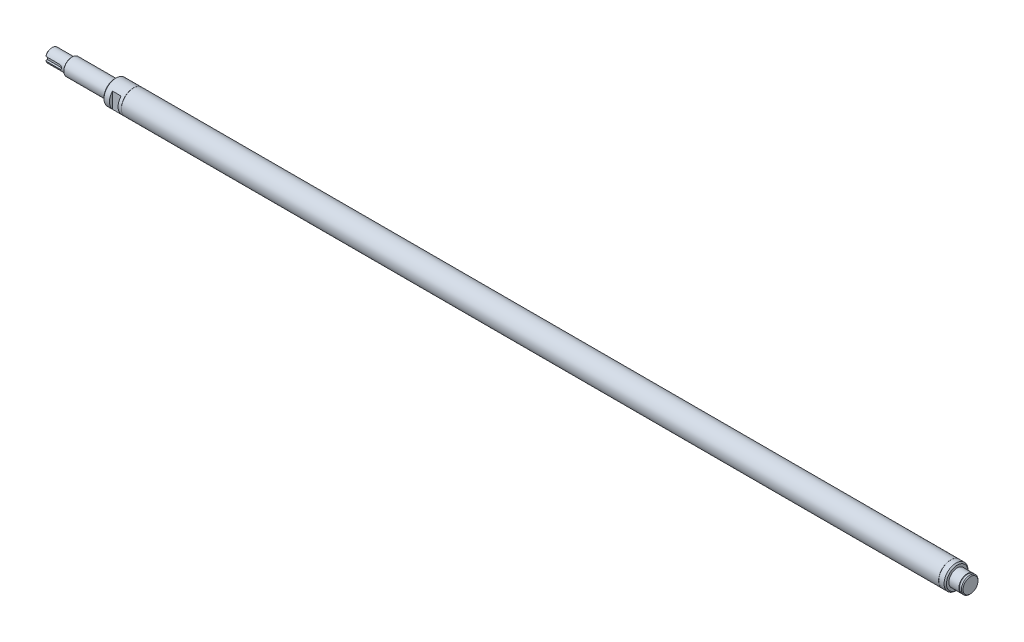
from build123d import *

# Parameters (mm, degrees)
SKETCH1_W          = 1229
SKETCH1_H          = 18
SKETCH3_W          = 13
SKETCH3_H          = 36
CUT_EXTRUDE1_DEPTH = 9
SKETCH4_W          = 13
SKETCH4_H          = 36
CUT_EXTRUDE2_DEPTH = 9
CUT_EXTRUDE3_DEPTH = 3.5


with BuildPart() as part:
    # Sketch1 → Revolve1 (revolve)
    with BuildSketch(Plane.XY, mode=Mode.PRIVATE) as revolve1_sk:
        with Locations((619.5, 9)):
            Rectangle(SKETCH1_W, SKETCH1_H)
    revolve(revolve1_sk.sketch.rotate(Axis((1234, 0, 0), (-1, 0, 0)), 180), axis=Axis((1234, 0, 0), (-1, 0, 0)))

    # Sketch2 → Revolve2 (revolve)
    with BuildSketch(Plane.XY, mode=Mode.PRIVATE) as revolve2_sk:
        Polygon((-118, 0), (-118, 8.888888889), (-116.888888889, 10), (-88, 10), (-88, 11.58), (-87.08, 12.5), (-23, 12.5), (-23, 16.2), (-21.2, 18), (4.8, 18), (4.8, 14.4), (5, 14.4), (5, 0), align=None)
    revolve(revolve2_sk.sketch.rotate(Axis((5, 0, 0), (-1, 0, 0)), 180), axis=Axis((5, 0, 0), (-1, 0, 0)))

    # Sketch3 → Cut-Extrude1 (cut)
    with BuildSketch(Plane.XY.offset(13.5)):
        with Locations((-6.5, 0)):
            Rectangle(SKETCH3_W, SKETCH3_H)
    extrude(amount=CUT_EXTRUDE1_DEPTH, mode=Mode.SUBTRACT)

    # Sketch4 → Cut-Extrude2 (cut)
    with BuildSketch(Plane.XY.offset(-13.5)):
        with Locations((-6.5, 0)):
            Rectangle(SKETCH4_W, SKETCH4_H)
    extrude(amount=-CUT_EXTRUDE2_DEPTH, mode=Mode.SUBTRACT)

    # Sketch5 → Cut-Extrude3 (cut)
    with BuildSketch(Plane.XY.offset(10)):
        with BuildLine():
            Line((-118, -3), (-96, -3))
            ThreePointArc((-96, -3), (-93, 0), (-96, 3))
            Line((-96, 3), (-118, 3))
            Line((-118, 3), (-118, -3))
        make_face()
    extrude(amount=-CUT_EXTRUDE3_DEPTH, mode=Mode.SUBTRACT)

    # Sketch6 → Revolve3 (revolve)
    with BuildSketch(Plane.XY, mode=Mode.PRIVATE) as revolve3_sk:
        Polygon((1234, 0), (1234, 14.4), (1234.2, 14.4), (1234.2, 18), (1242.2, 18), (1244, 16.2), (1244, 12.5), (1259, 12.5), (1259, 11.95), (1260.35, 11.95), (1260.35, 12.5), (1262.75, 12.5), (1264, 11.25), (1264, 0), align=None)
    revolve(revolve3_sk.sketch.rotate(Axis((1264, 0, 0), (-1, 0, 0)), 180), axis=Axis((1264, 0, 0), (-1, 0, 0)))


solid = part.part
